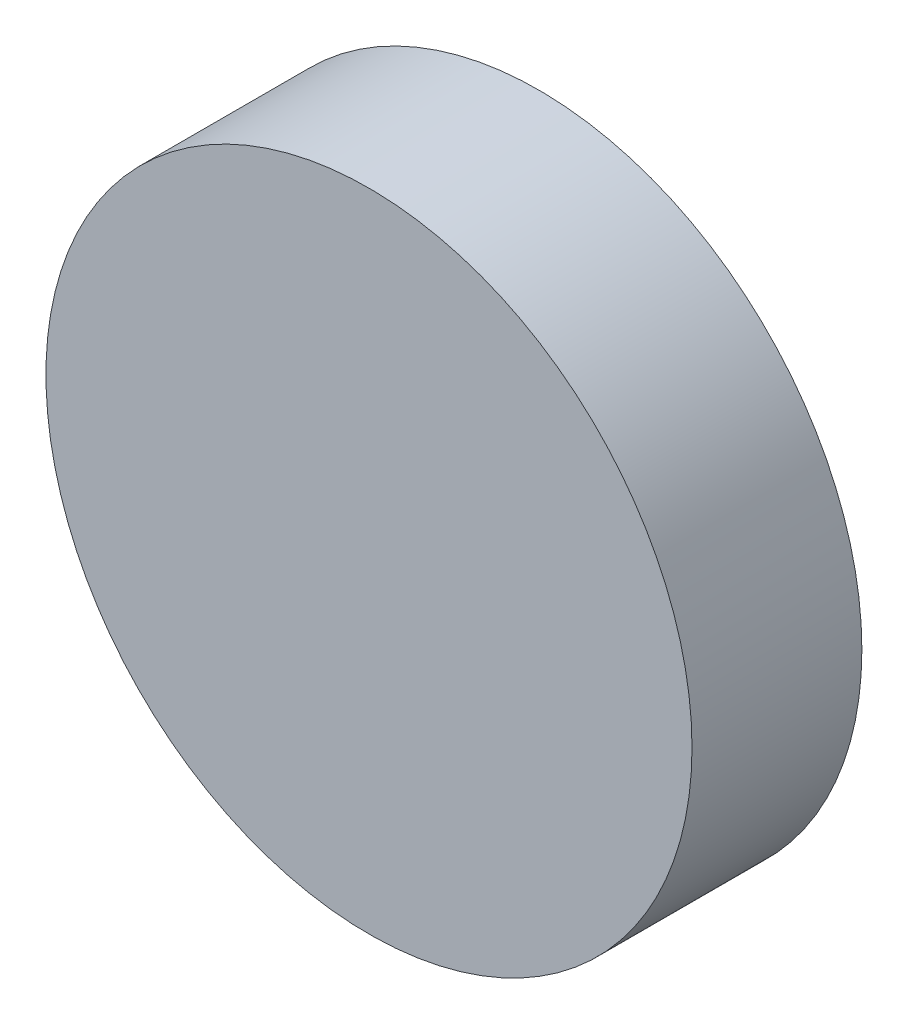
from build123d import *

# Parameters (mm, degrees)
SKETCH_1_R      = 19.017433949
EXTRUDE_1_DEPTH = 10


with BuildPart() as part:
    # Эскиз1 → Бобышка-Вытянуть1 (new body)
    with BuildSketch(Plane.XY):
        Circle(SKETCH_1_R)
    extrude(amount=EXTRUDE_1_DEPTH)


solid = part.part
